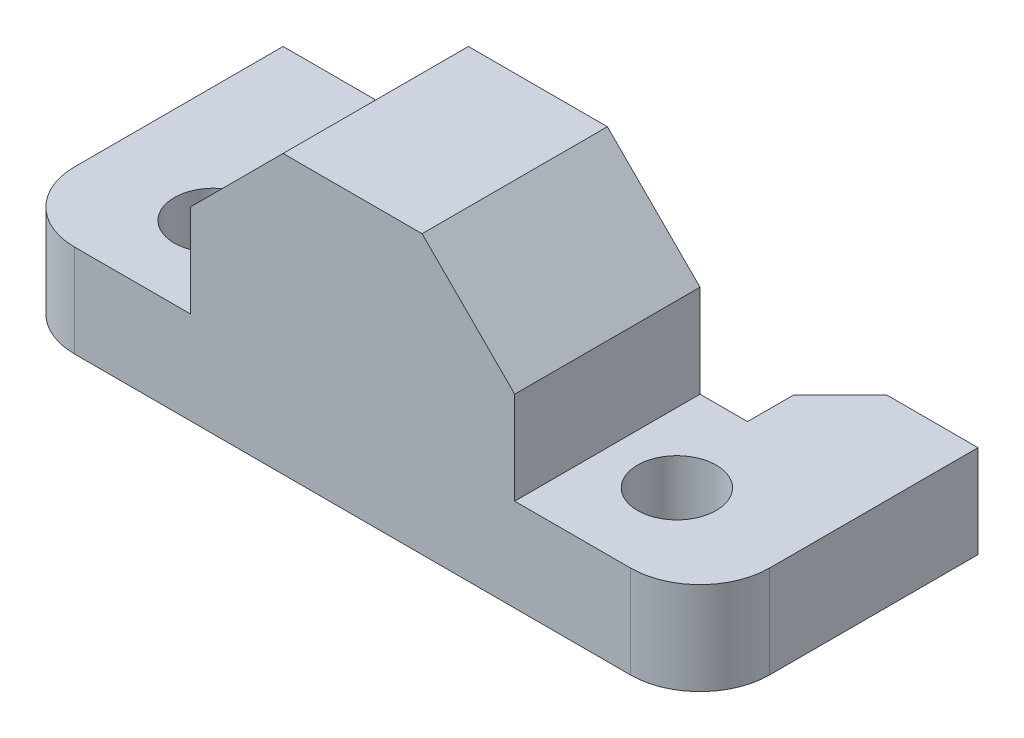
from build123d import *

# Parameters (mm, degrees)
SKETCH1_W           = 30
SKETCH1_H           = 8
SKETCH1_R           = 1.7
BOSS_EXTRUDE1_DEPTH = 4
FILLET1_R           = 3
SKETCH2_W           = 5.95
SKETCH2_H           = 4
BOSS_EXTRUDE2_DEPTH = 4
SKETCH3_W           = 14
SKETCH3_H           = 8
BOSS_EXTRUDE3_DEPTH = 8
CHAMFER1_SIZE       = 4
CHAMFER2_SIZE       = 2


with BuildPart() as part:
    # Sketch1 → Boss-Extrude1 (new body)
    with BuildSketch(Plane(origin=(0, 0, 0), x_dir=(1, 0, 0), z_dir=(0, 1, 0))):
        with Locations((10, 0)):
            Rectangle(SKETCH1_W, SKETCH1_H)
        with Locations(Location((0, 0, 0), (0, 0, 270))):
            Circle(SKETCH1_R, mode=Mode.SUBTRACT)
        with Locations(Location((20, 0, 0), (0, 0, 270))):
            Circle(SKETCH1_R, mode=Mode.SUBTRACT)
    extrude(amount=BOSS_EXTRUDE1_DEPTH)

    # Fillet1
    fillet1_edges = [part.edges().sort_by_distance(p)[0] for p in [
        (25, 2, 4),
        (-5, 2, 4),
    ]]
    fillet(fillet1_edges, radius=FILLET1_R)

    # Sketch2 → Boss-Extrude2 (add)
    with BuildSketch(Plane(origin=(0, 4, 0), x_dir=(1, 0, 0), z_dir=(0, 1, 0))):
        with Locations((-2.025, 6)):
            Rectangle(SKETCH2_W, SKETCH2_H)
        with Locations((22.025, 6)):
            Rectangle(SKETCH2_W, SKETCH2_H)
    extrude(amount=-BOSS_EXTRUDE2_DEPTH)

    # Sketch3 → Boss-Extrude3 (add)
    with BuildSketch(Plane(origin=(0, 4, 0), x_dir=(1, 0, 0), z_dir=(0, 1, 0))):
        with Locations((10, 0)):
            Rectangle(SKETCH3_W, SKETCH3_H)
    extrude(amount=BOSS_EXTRUDE3_DEPTH)

    # Chamfer1
    chamfer1_edges = [part.edges().sort_by_distance(p)[0] for p in [
        (17, 12, 0),
        (3, 12, 0),
    ]]
    chamfer(chamfer1_edges, length=CHAMFER1_SIZE)

    # Chamfer2
    chamfer2_edges = [part.edges().sort_by_distance(p)[0] for p in [
        (0.95, 2, -8),
        (19.05, 2, -8),
    ]]
    chamfer(chamfer2_edges, length=CHAMFER2_SIZE)


solid = part.part
